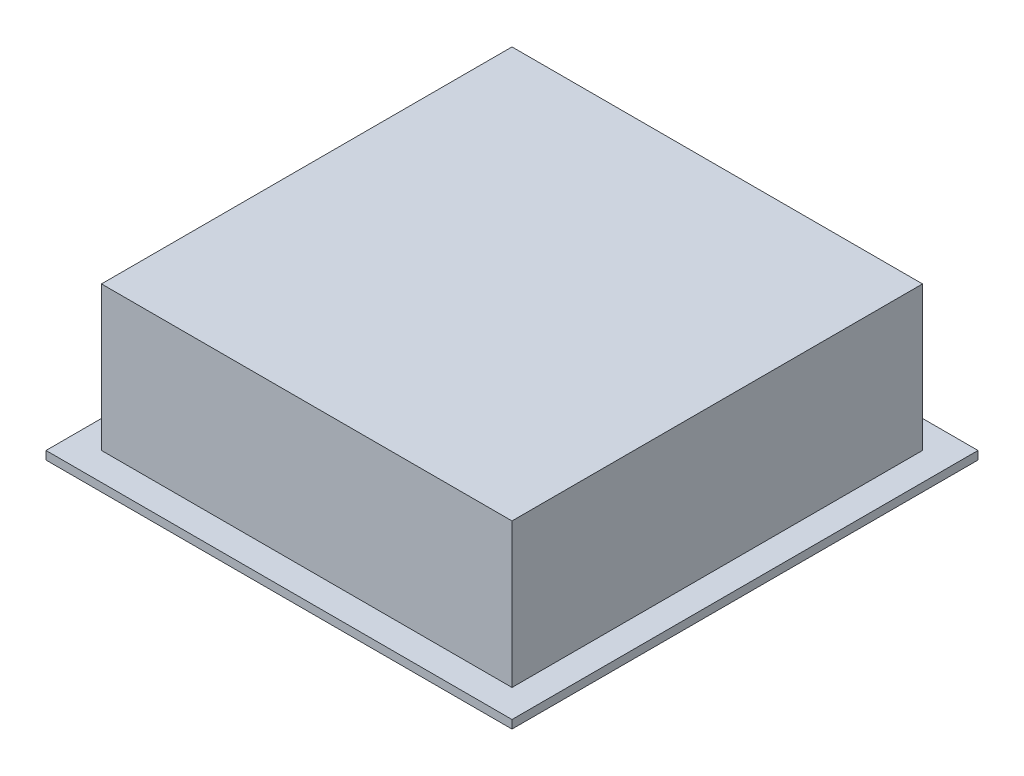
from build123d import *

# Parameters (mm, degrees)
SKETCH_1_W      = 84
SKETCH_1_H      = 84
EXTRUDE_1_DEPTH = 1.5
SKETCH_2_W      = 74
SKETCH_2_H      = 74
EXTRUDE_2_DEPTH = 26
SKETCH_3_W      = 74
SKETCH_3_H      = 74
EXTRUDE_3_DEPTH = 1


with BuildPart() as part:
    # 草图1 → 凸台-拉伸1 (new body)
    with BuildSketch(Plane(origin=(0, 0, 0), x_dir=(1, 0, 0), z_dir=(0, 1, 0))):
        with Locations((1.82278481, -10.17721519)):
            Rectangle(SKETCH_1_W, SKETCH_1_H)
    extrude(amount=EXTRUDE_1_DEPTH)

    # 草图2 → 凸台-拉伸2 (add)
    with BuildSketch(Plane(origin=(0, 1.5, 0), x_dir=(1, 0, 0), z_dir=(0, 1, 0))):
        with Locations((1.82278481, -10.17721519)):
            Rectangle(SKETCH_2_W, SKETCH_2_H)
    extrude(amount=EXTRUDE_2_DEPTH)

    # 草图3 → 凸台-拉伸3 (add)
    with BuildSketch(Plane.XZ):
        with Locations((1.82278481, 10.17721519)):
            Rectangle(SKETCH_3_W, SKETCH_3_H)
    extrude(amount=EXTRUDE_3_DEPTH)


solid = part.part
